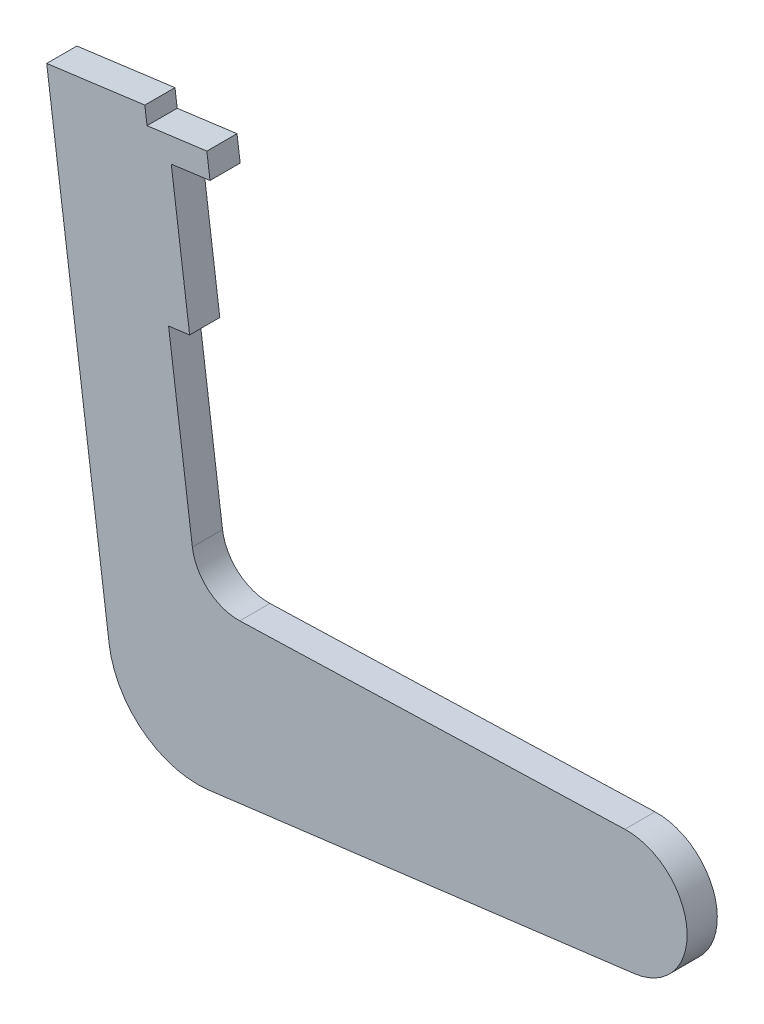
from build123d import *

# Parameters (mm, degrees)
BOSS_EXTRUDE1_DEPTH = 1.5875


with BuildPart() as part:
    # Sketch2 → Boss-Extrude1 (new, symmetric)
    with BuildSketch(Plane.XY):
        with BuildLine():
            Line((0.022257802, 9.82186659), (-2.479270797, 28.706909737))
            Line((-2.479270797, 28.706909737), (-0.263425734, 29.000422426))
            Line((-0.263425734, 29.000422426), (-2.197941184, 43.604855793))
            Line((-2.197941184, 43.604855793), (1.881228135, 44.14518597))
            Line((1.881228135, 44.14518597), (1.547690989, 46.663191723))
            Line((1.547690989, 46.663191723), (-4.747323394, 45.829348857))
            Line((-4.747323394, 45.829348857), (-4.980799396, 47.591952884))
            Line((-4.980799396, 47.591952884), (-15.304622983, 46.224450583))
            Line((-15.304622983, 46.224450583), (-8.733941196, -3.38026275))
            ThreePointArc((-8.733941196, -3.38026275), (-5.154398694, -9.589912307), (1.762103428, -11.470037447))
            Line((1.762103428, -11.470037447), (46.530195884, -5.807878402))
            ThreePointArc((46.530195884, -5.807878402), (52.07, 0.997941592), (45.533364229, 6.85294016))
            Line((45.533364229, 6.85294016), (5.015377017, 5.582956452))
            ThreePointArc((5.015377017, 5.582956452), (1.702583701, 6.740949239), (0.022257802, 9.82186659))
        make_face()
    extrude(amount=BOSS_EXTRUDE1_DEPTH, both=True)


solid = part.part
